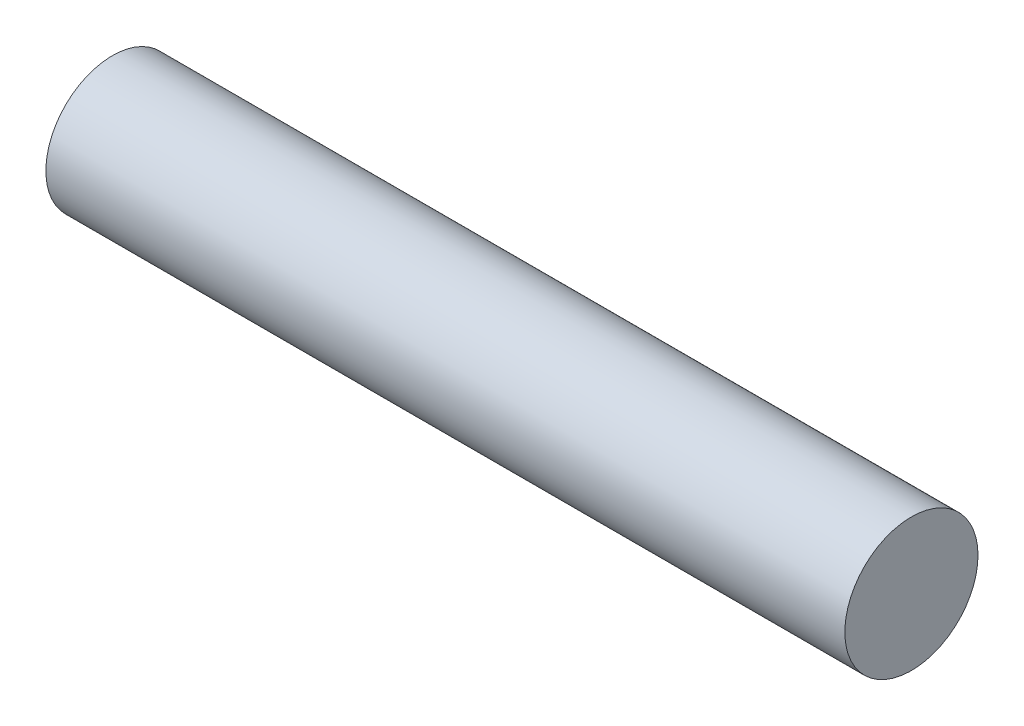
from build123d import *

# Parameters (mm, degrees)
ESQUISSE1_R        = 1
BOSS_EXTRU_1_DEPTH = 12


with BuildPart() as part:
    # Esquisse1 → Boss.-Extru.1 (new body)
    with BuildSketch(Plane(origin=(0, 0, 0), x_dir=(0, 0, -1), z_dir=(1, 0, 0))):
        Circle(ESQUISSE1_R)
    extrude(amount=BOSS_EXTRU_1_DEPTH)


solid = part.part
